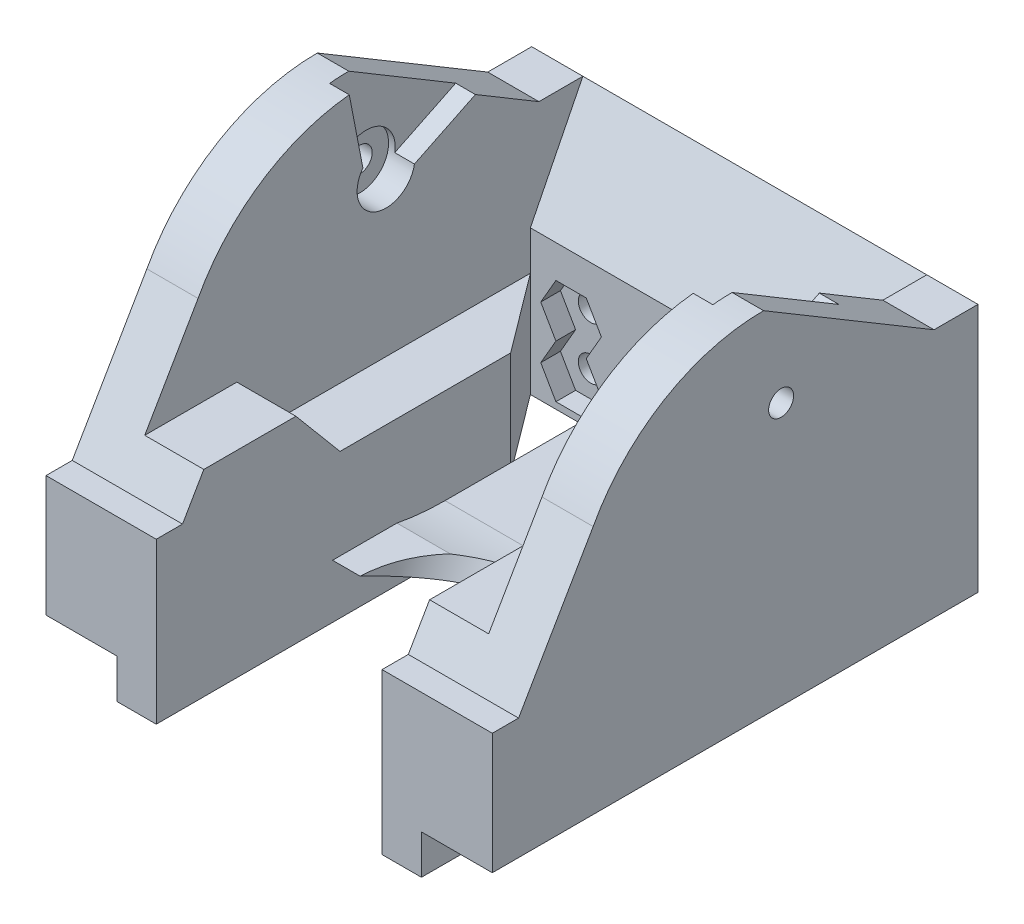
from build123d import *

# Parameters (mm, degrees)
CROQUIS1_W               = 34
CROQUIS1_H               = 19
SALIENTE_EXTRUIR1_DEPTH  = 35
CROQUIS2_W               = 26.2
CROQUIS2_H               = 31
CORTAR_EXTRUIR1_DEPTH    = 25
CORTAR_EXTRUIR3_DEPTH    = 26.2
SALIENTE_EXTRUIR2_DEPTH  = 34
CROQUIS10_W              = 26.2
CROQUIS10_H              = 25.966324345
CORTAR_EXTRUIR4_DEPTH    = 10
CROQUIS18_R              = 0.95
CORTAR_EXTRUIR11_DEPTH   = 4
CORTAR_EXTRUIR12_DEPTH   = 1.5
CORTAR_EXTRUIR14_START   = -34
CROQUIS21_R              = 0.95
CORTAR_EXTRUIR14_DEPTH   = 34
SALIENTE_EXTRUIR3_DEPTH  = 8
CROQUIS25_W              = 3
CROQUIS25_H              = 25
SALIENTE_EXTRUIR4_DEPTH  = 3
CROQUIS43_W              = 4.5
CROQUIS43_H              = 12
SALIENTE_EXTRUIR8_DEPTH  = 4
CORTAR_EXTRUIR20_START   = -1.5
CORTAR_EXTRUIR20_DEPTH   = 1.5
CORTAR_EXTRUIR21_DEPTH   = 27.7
CORTAR_EXTRUIR22_START   = -34
CORTAR_EXTRUIR22_DEPTH   = 34
CROQUIS36_R              = 2.2
CORTAR_EXTRUIR24_DEPTH   = 2
CORTAR_EXTRUIR25_START   = 28.2
CROQUIS36_2_R            = 2.2
CORTAR_EXTRUIR25_DEPTH   = 28.2
CORTAR_EXTRUIR26_START   = -34
CORTAR_EXTRUIR26_DEPTH   = 34
CORTAR_EXTRUIR28_START   = -23.2
CORTAR_EXTRUIR28_DEPTH   = 23.2
CORTAR_EXTRUIR29_DEPTH   = 26.2
SALIENTE_EXTRUIR9_DEPTH  = 17.2
CROQUIS49_R              = 6.5
CROQUIS50_R              = 6.5
CROQUIS53_W              = 17.2
CROQUIS53_H              = 1.49981493
SALIENTE_EXTRUIR13_DEPTH = 11
SALIENTE_EXTRUIR14_DEPTH = 17.2
SALIENTE_EXTRUIR15_DEPTH = 2
CORTAR_EXTRUIR30_DEPTH   = 20


with BuildPart() as part:
    # Croquis1 → Saliente-Extruir1 (new body)
    with BuildSketch(Plane.XY):
        with Locations((-31.887263086, 5.12254902)):
            Rectangle(CROQUIS1_W, CROQUIS1_H)
    extrude(amount=SALIENTE_EXTRUIR1_DEPTH)

    # Croquis2 → Cortar-Extruir1 (cut)
    with BuildSketch(Plane.XZ.offset(4.37745098)):
        with Locations((-31.887263086, 19.5)):
            Rectangle(CROQUIS2_W, CROQUIS2_H)
    extrude(amount=-CORTAR_EXTRUIR1_DEPTH, mode=Mode.SUBTRACT)

    # Croquis4 → Cortar-Extruir3 (cut)
    with BuildSketch(Plane.ZY.offset(18.787263086)):
        Polygon((4, 14.62254902), (4, 6.62254902), (0, 14.62254902), align=None)
    extrude(amount=CORTAR_EXTRUIR3_DEPTH, mode=Mode.SUBTRACT)

    # Croquis9 → Saliente-Extruir2 (add)
    with BuildSketch(Plane(origin=(-14.887263086, 0, 0), x_dir=(0, 0, -1), z_dir=(1, 0, 0))):
        with BuildLine():
            Line((-29.315831827, 14.62254902), (-3.349507482, 14.62254902))
            ThreePointArc((-3.349507482, 14.62254902), (-16.332669655, 22.37254902), (-29.315831827, 14.62254902))
        make_face()
    extrude(amount=-SALIENTE_EXTRUIR2_DEPTH)

    # Croquis10 → Cortar-Extruir4 (cut)
    with BuildSketch(Plane.XZ.offset(-14.62254902)):
        with Locations((-31.887263086, 16.332669655)):
            Rectangle(CROQUIS10_W, CROQUIS10_H)
    extrude(amount=-CORTAR_EXTRUIR4_DEPTH, mode=Mode.SUBTRACT)

    # Croquis18 → Cortar-Extruir11 (cut)
    with BuildSketch(Plane(origin=(0, 0, 0), x_dir=(-1, 0, 0), z_dir=(0, 0, -1))):
        with Locations((41.887263086, -1.87745098)):
            Circle(CROQUIS18_R)
        with Locations((21.887263086, -1.87745098)):
            Circle(CROQUIS18_R)
        with Locations((21.887263086, 2.12254902)):
            Circle(CROQUIS18_R)
        with Locations((41.887263086, 2.12254902)):
            Circle(CROQUIS18_R)
    extrude(amount=-CORTAR_EXTRUIR11_DEPTH, mode=Mode.SUBTRACT)

    # Croquis19 → Cortar-Extruir12 (cut)
    with BuildSketch(Plane.XY.offset(4)):
        Polygon((-44.197263086, -1.87745098), (-43.042263086, -3.877969663), (-40.732263086, -3.877969663), (-39.577263086, -1.87745098), (-40.731963624, 0.12254902), (-39.577263086, 2.12254902), (-40.732263086, 4.123067702), (-43.042263086, 4.123067702), (-44.197263086, 2.12254902), (-43.042562547, 0.12254902), align=None)
        Polygon((-24.197263086, -1.87745098), (-23.042263086, -3.877969663), (-20.732263086, -3.877969663), (-19.577263086, -1.87745098), (-20.731963624, 0.12254902), (-19.577263086, 2.12254902), (-20.732263086, 4.123067702), (-23.042263086, 4.123067702), (-24.197263086, 2.12254902), (-23.042562547, 0.12254902), align=None)
    extrude(amount=-CORTAR_EXTRUIR12_DEPTH, mode=Mode.SUBTRACT)

    # Croquis21 → Cortar-Extruir14 (cut)
    with BuildSketch(Plane(origin=(-14.887263086, 0, 0), x_dir=(0, 0, -1), z_dir=(1, 0, 0)).offset(CORTAR_EXTRUIR14_START)):
        with Locations((-15, 15.62254902)):
            Circle(CROQUIS21_R)
    extrude(amount=CORTAR_EXTRUIR14_DEPTH, mode=Mode.SUBTRACT)

    # Croquis23 → Saliente-Extruir3 (add)
    with BuildSketch(Plane.XZ.offset(4.37745098)):
        Polygon((-44.987263086, 35), (-40.487263086, 35), (-40.487263086, 10), (-44.987263086, 4), align=None)
        Polygon((-18.787263086, 35), (-23.287263086, 35), (-23.287263086, 10), (-18.787263086, 4), align=None)
    extrude(amount=-SALIENTE_EXTRUIR3_DEPTH)

    # Croquis25 → Saliente-Extruir4 (add)
    with BuildSketch(Plane.XZ.offset(4.37745098)):
        with Locations((-41.987263086, 22.5)):
            Rectangle(CROQUIS25_W, CROQUIS25_H)
        with Locations((-21.787263086, 22.5)):
            Rectangle(CROQUIS25_W, CROQUIS25_H)
    extrude(amount=SALIENTE_EXTRUIR4_DEPTH)

    # Croquis43 → Saliente-Extruir8 (add)
    with BuildSketch(Plane(origin=(0, 3.62254902, 0), x_dir=(1, 0, 0), z_dir=(0, 1, 0))):
        with Locations((-21.037263086, -29)):
            Rectangle(CROQUIS43_W, CROQUIS43_H)
        with Locations((-42.737263086, -29)):
            Rectangle(CROQUIS43_W, CROQUIS43_H)
    extrude(amount=SALIENTE_EXTRUIR8_DEPTH)

    # Croquis29 → Cortar-Extruir20 (cut)
    with BuildSketch(Plane.ZY.offset(18.787263086).offset(CORTAR_EXTRUIR20_START)):
        with BuildLine():
            Line((17.797402962, 22.299641931), (16.5, 15.62254902))
            ThreePointArc((16.5, 15.62254902), (15.426958984, 14.184596995), (13.743058632, 14.803953638))
            Line((13.743058632, 14.803953638), (6.296886003, 18.432060872))
            ThreePointArc((6.296886003, 18.432060872), (11.631045274, 21.603150873), (17.797402962, 22.299641931))
        make_face()
    extrude(amount=CORTAR_EXTRUIR20_DEPTH, mode=Mode.SUBTRACT)

    # Croquis29<2> → Cortar-Extruir21 (cut)
    with BuildSketch(Plane.ZY.offset(18.787263086)):
        with BuildLine():
            Line((17.797402962, 22.299641931), (16.5, 15.62254902))
            ThreePointArc((16.5, 15.62254902), (15.426958984, 14.184596995), (13.743058632, 14.803953638))
            Line((13.743058632, 14.803953638), (6.296886003, 18.432060872))
            ThreePointArc((6.296886003, 18.432060872), (11.631045274, 21.603150873), (17.797402962, 22.299641931))
        make_face()
    extrude(amount=CORTAR_EXTRUIR21_DEPTH, mode=Mode.SUBTRACT)

    # Croquis30 → Cortar-Extruir22 (cut)
    with BuildSketch(Plane.ZY.offset(48.887263086).offset(CORTAR_EXTRUIR22_START)):
        Polygon((29.315831827, 14.62254902), (35, 4.827802707), (35, 14.62254902), align=None)
    extrude(amount=CORTAR_EXTRUIR22_DEPTH, mode=Mode.SUBTRACT)

    # Croquis36 → Cortar-Extruir24 (cut)
    with BuildSketch(Plane.ZY.offset(18.787263086)):
        with Locations((15, 15.62254902)):
            Circle(CROQUIS36_R)
    extrude(amount=-CORTAR_EXTRUIR24_DEPTH, mode=Mode.SUBTRACT)

    # Croquis36<2> → Cortar-Extruir25 (cut)
    with BuildSketch(Plane.ZY.offset(18.787263086).offset(CORTAR_EXTRUIR25_START)):
        with Locations((15, 15.62254902)):
            Circle(CROQUIS36_2_R)
    extrude(amount=-CORTAR_EXTRUIR25_DEPTH, mode=Mode.SUBTRACT)

    # Croquis38 → Cortar-Extruir26 (cut)
    with BuildSketch(Plane.ZY.offset(48.887263086).offset(CORTAR_EXTRUIR26_START)):
        Polygon((3.349507482, 14.62254902), (16.332669655, 22.37254902), (3.349507482, 22.37254902), align=None)
    extrude(amount=CORTAR_EXTRUIR26_DEPTH, mode=Mode.SUBTRACT)

    # Croquis41 → Cortar-Extruir28 (cut)
    with BuildSketch(Plane(origin=(-20.287263086, 0, 0), x_dir=(0, 0, -1), z_dir=(1, 0, 0)).offset(CORTAR_EXTRUIR28_START)):
        Polygon((-10, -4.37745098), (-10, -7.37745098), (-13, -7.37745098), align=None)
    extrude(amount=CORTAR_EXTRUIR28_DEPTH, mode=Mode.SUBTRACT)

    # Croquis44 → Cortar-Extruir29 (cut)
    with BuildSketch(Plane.ZY.offset(18.787263086)):
        Polygon((23, 7.62254902), (26.362551066, 7.62254902), (23, 3.62254902), align=None)
    extrude(amount=CORTAR_EXTRUIR29_DEPTH, mode=Mode.SUBTRACT)



with BuildPart() as body_2:
    # Croquis45 → Saliente-Extruir9 (new body)
    with BuildSketch(Plane.ZY.offset(23.287263086)):
        with BuildLine():
            Line((32.372332418, 4.275439874), (31.142668885, 5.135569413))
            ThreePointArc((31.142668885, 5.135569413), (24.183902835, -1.295442254), (15, -3.62745098))
            Line((15, -3.62745098), (15, -5.12726591))
            ThreePointArc((15, -5.12726591), (24.876851848, -2.625810281), (32.372332418, 4.275439874))
        make_face()
    extrude(amount=SALIENTE_EXTRUIR9_DEPTH)

    # Cortar-Barrer2: sweep along a path in Croquis47
    with BuildLine(Plane(origin=(-31.887263086, 4.275439874, 32.372332418), x_dir=(0, 0, -1), z_dir=(1, 0, 0))) as cortar_barrer2_path:
        Line((17.372332418, 11.347109145), (-5.570725036, -21.418972626))
    # Croquis48 → Cortar-Barrer2 (sweep, cut)
    with BuildSketch(Plane(origin=(-31.887263086, -17.143532752, 37.943057454), x_dir=(-1, 0, 0), z_dir=(0, -0.8191520442889911, 0.5735764363510472))):
        with BuildLine():
            Line((6.5, 0), (6.5, -15))
            Line((6.5, -15), (-6.5, -15))
            Line((-6.5, -15), (-6.5, 0))
            ThreePointArc((-6.5, 0), (0, 6.5), (6.5, 0))
        make_face()
    sweep(path=cortar_barrer2_path.line, mode=Mode.SUBTRACT)

    # Cortar-Barrer3: sweep along a path in Croquis51
    with BuildLine(Plane(origin=(-31.887263086, 4.275439874, 32.372332418), x_dir=(0, 0, -1), z_dir=(1, 0, 0))) as cortar_barrer3_path:
        Line((17.372332418, 11.347109145), (-2.627667582, -23.293907006))
    # Croquis49 → Cortar-Barrer3 (sweep, cut)
    with BuildSketch(Plane(origin=(-31.887263086, -19.018467132, 35), x_dir=(-1, 0, 0), z_dir=(0, -0.8660254037844382, 0.5000000000000011))):
        Circle(CROQUIS49_R)
    sweep(path=cortar_barrer3_path.line, mode=Mode.SUBTRACT)

    # Cortar-Barrer4: sweep along a path in Croquis52
    with BuildLine(Plane(origin=(-31.887263086, 4.275439874, 32.372332418), x_dir=(0, 0, -1), z_dir=(1, 0, 0))) as cortar_barrer4_path:
        Line((17.372332418, 11.347109145), (0.467601948, -24.905202336))
    # Croquis50 → Cortar-Barrer4 (sweep, cut)
    with BuildSketch(Plane(origin=(-31.887263086, -20.629762462, 31.90473047), x_dir=(-1, 0, 0), z_dir=(0, -0.9063077870366495, 0.4226182617407004))):
        Circle(CROQUIS50_R)
    sweep(path=cortar_barrer4_path.line, mode=Mode.SUBTRACT)

    # Croquis58 → Cortar-Extruir30 (cut)
    with BuildSketch(Plane.XY.offset(37)):
        Polygon((-40.487263086, -1.274824137), (-40.487263086, 6.807025189), (-23.287263086, 6.807025189), (-23.287263086, -1.274824137), (-23.287263086, -3.274824137), (-40.487263086, -3.274824137), align=None)
    extrude(amount=-CORTAR_EXTRUIR30_DEPTH, mode=Mode.SUBTRACT)


with BuildPart() as body_3:
    # Croquis53 → Saliente-Extruir13 (new body)
    with BuildSketch(Plane(origin=(0, 0, 15), x_dir=(-1, 0, 0), z_dir=(0, 0, -1))):
        with Locations((31.887263086, -4.377358445)):
            Rectangle(CROQUIS53_W, CROQUIS53_H)
    extrude(amount=SALIENTE_EXTRUIR13_DEPTH)


with BuildPart() as part_1:
    add(part.part)

    add(body_3.part)  # Saliente-Extruir14 merges body 3
    # Croquis55 → Saliente-Extruir14 (add)
    with BuildSketch(Plane.ZY.offset(40.487263086)):
        Polygon((4, -5.12726591), (4, -4.377358445), (0, -4.377358445), align=None)
    extrude(amount=-SALIENTE_EXTRUIR14_DEPTH)

    # Croquis56 → Saliente-Extruir15 (add)
    with BuildSketch(Plane.XY.offset(35)):
        Polygon((-23.287263086, -7.37745098), (-20.287263086, -7.37745098), (-20.287263086, -4.37745098), (-14.887263086, -4.37745098), (-14.887263086, 4.827802707), (-23.287263086, 4.827802707), align=None)
        Polygon((-40.487263086, -7.37745098), (-40.487263086, 4.827802707), (-48.887263086, 4.827802707), (-48.887263086, -4.37745098), (-43.487263086, -4.37745098), (-43.487263086, -7.37745098), align=None)
    extrude(amount=SALIENTE_EXTRUIR15_DEPTH)


solid = Compound([body_2.part, part_1.part])
